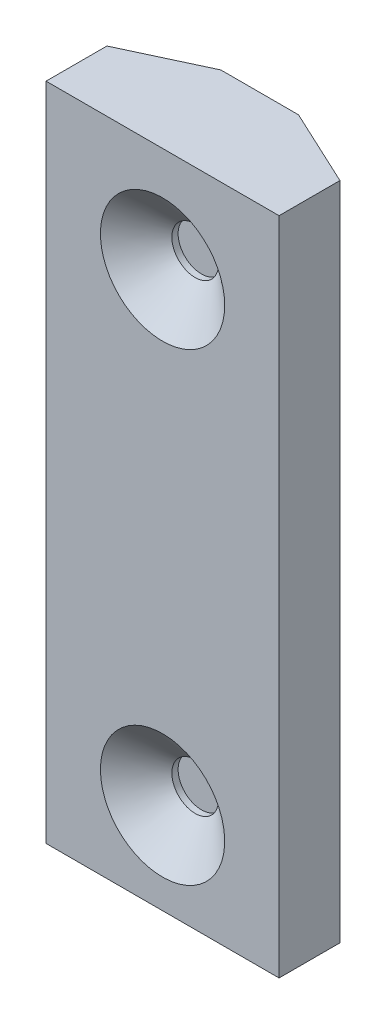
from build123d import *

# Parameters (mm, degrees)
EXTRUDE_1_DEPTH     = 17
SKETCH_2_R          = 0.6
CUT_EXTRUDE_1_DEPTH = 1
CHAMFER_1_SIZE      = 1
CHAMFER_1_SIZE2     = 0.839099631


with BuildPart() as part:
    # Эскиз1 → Бобышка-Вытянуть1 (new body)
    with BuildSketch(Plane(origin=(0, 0, 0), x_dir=(1, 0, 0), z_dir=(0, 1, 0))):
        Polygon((3, 0), (-3, 0), (-3, 1.567384684), (-1, 2.5), (1, 2.5), (3, 1.567384684), align=None)
    extrude(amount=EXTRUDE_1_DEPTH)

    # Эскиз2 → Вырез-Вытянуть1 (cut)
    with BuildSketch(Plane.XY):
        with Locations((0, 2.35)):
            Circle(SKETCH_2_R)
        with Locations((0, 14.3)):
            Circle(SKETCH_2_R)
    extrude(amount=-CUT_EXTRUDE_1_DEPTH, mode=Mode.SUBTRACT)

    # Фаска1
    chamfer_1_edges = [part.edges().sort_by_distance(p)[0] for p in [
        (-0.6, 2.35, 0),
        (-0.6, 14.3, 0),
    ]]
    chamfer_1_side = [part.faces().sort_by_distance(p)[0] for p in [
        (0, 8.503968803, 0),
    ]]
    chamfer(chamfer_1_edges, length=CHAMFER_1_SIZE, length2=CHAMFER_1_SIZE2, reference=chamfer_1_side[0])


solid = part.part
